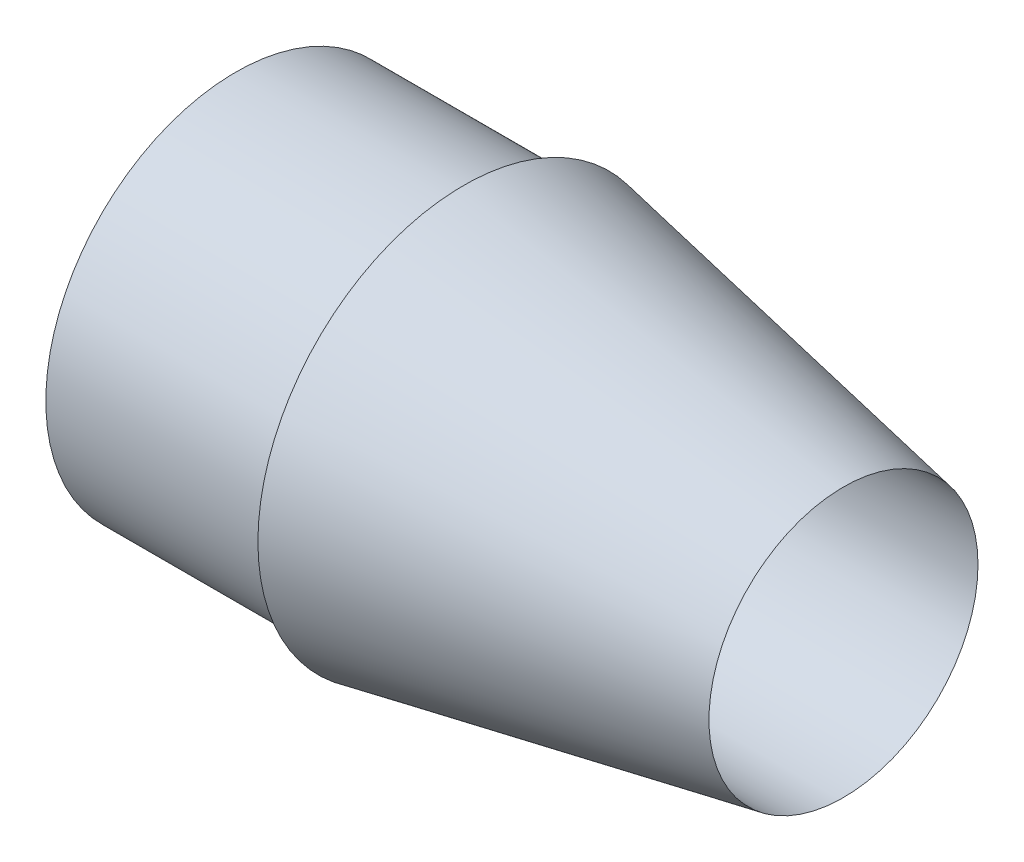
from build123d import *


with BuildPart() as part:
    # Sketch2 → Revolve1 (revolve)
    with BuildSketch(Plane.XY, mode=Mode.PRIVATE) as revolve1_sk:
        with BuildLine():
            Line((0, 26.9875), (76.2, 26.9875))
            Line((76.2, 26.9875), (0, 41.275))
            Line((0, 41.275), (0, 38.1))
            Line((0, 38.1), (-45.72, 38.1))
            Line((-45.72, 38.1), (-45.72, 34.925))
            Line((-45.72, 34.925), (-2.665476758, 25.68286532))
            ThreePointArc((-2.665476758, 25.68286532), (-1.340221916, 25.470914316), (0, 25.4))
            Line((0, 25.4), (0, 26.9875))
        make_face()
    revolve(revolve1_sk.sketch.rotate(Axis((109.22, 0, 0), (-1, 0, 0)), 90), axis=Axis((109.22, 0, 0), (-1, 0, 0)))


solid = part.part
